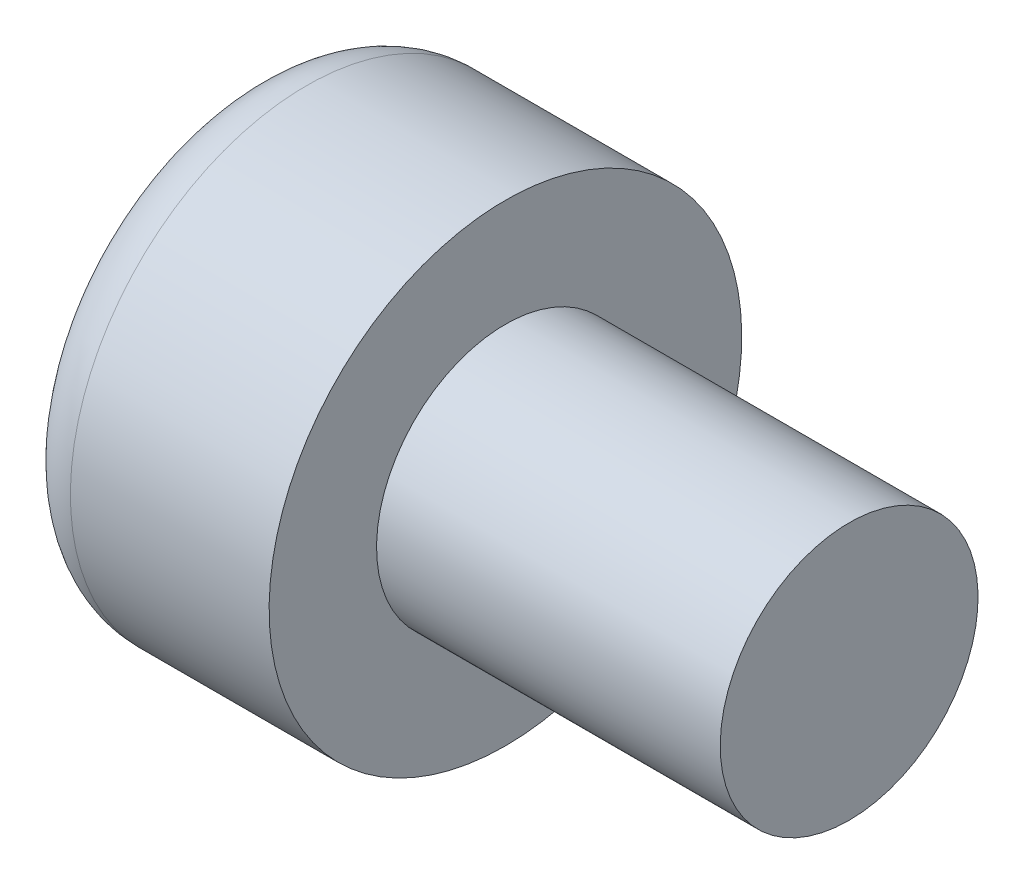
from build123d import *

# Parameters (mm, degrees)
CUT_EXTRUDE1_DEPTH = 1.5


with BuildPart() as part:
    # Sketch1 → Revolve1 (revolve)
    with BuildSketch(Plane.XY, mode=Mode.PRIVATE) as revolve1_sk:
        with BuildLine():
            Line((0, 0), (0, 2.0625))
            ThreePointArc((0, 2.0625), (0.201364088, 2.548635912), (0.6875, 2.75))
            Line((0.6875, 2.75), (3, 2.75))
            Line((3, 2.75), (3, 1.5))
            Line((3, 1.5), (7, 1.5))
            Line((7, 1.5), (7, 0))
            Line((7, 0), (0, 0))
        make_face()
    revolve(revolve1_sk.sketch.rotate(Axis((0, 0, 0), (1, 0, 0)), 180), axis=Axis((0, 0, 0), (1, 0, 0)))

    # Sketch2 → Cut-Extrude1 (cut)
    with BuildSketch(Plane.ZY):
        Polygon((0, 1.443375673), (-1.25, 0.721687836), (-1.25, -0.721687836), (0, -1.443375673), (1.25, -0.721687836), (1.25, 0.721687836), align=None)
    extrude(amount=-CUT_EXTRUDE1_DEPTH, mode=Mode.SUBTRACT)


solid = part.part
